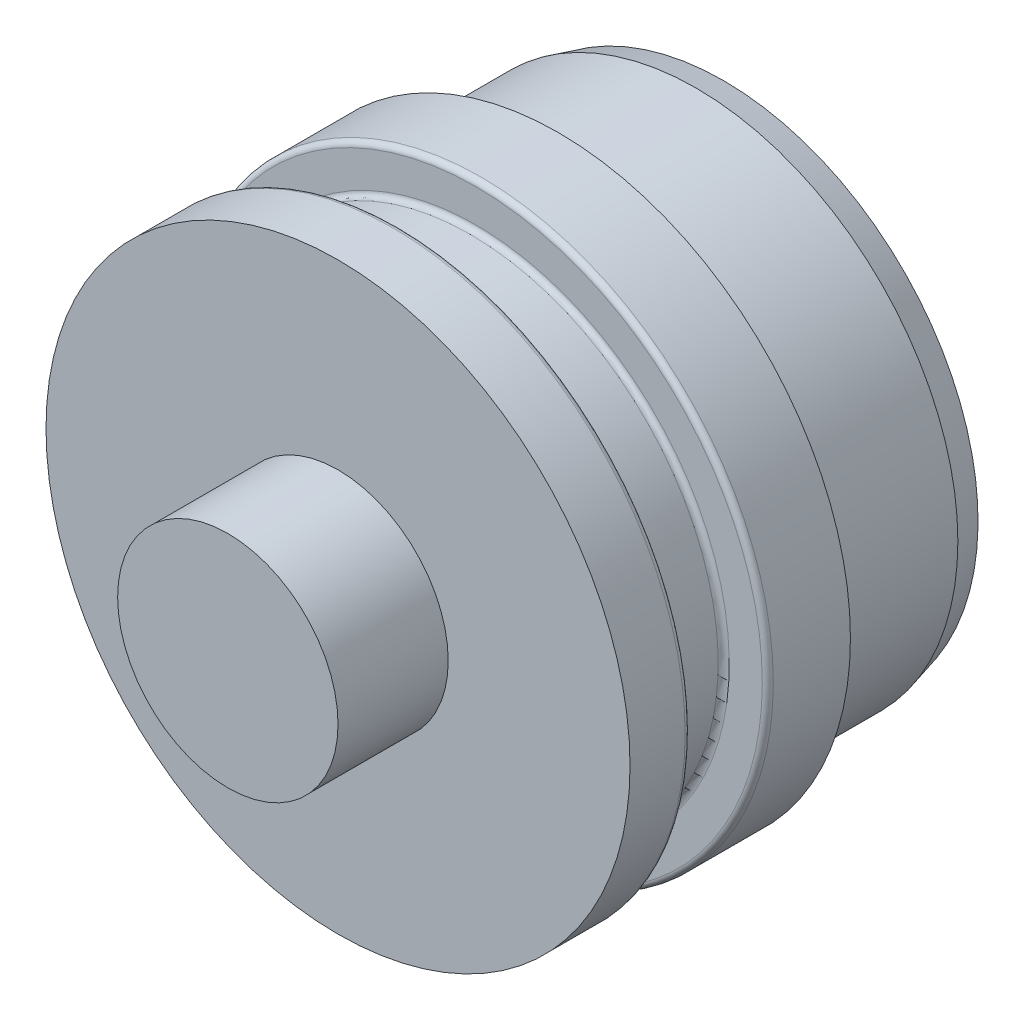
from build123d import *

# Parameters (mm, degrees)
CHAMFER1_SIZE  = 1.27
CHAMFER1_SIZE2 = 0.340295474
FILLET1_R      = 0.254


with BuildPart() as part:
    # Sketch1 → Revolve1 (revolve)
    with BuildSketch(Plane(origin=(0, 0, 0), x_dir=(0, 0, -1), z_dir=(1, 0, 0))):
        Polygon((0, 5.08), (0, 13.462), (2.794, 13.462), (2.794, 11.43), (6.35, 11.43), (6.35, 13.462), (10.16, 13.462), (10.16, 12.065), (17.78, 12.065), (17.78, 6.731), (5.08, 6.731), (5.08, 0), (0, 0), (-5.08, 0), (-5.08, 5.08), align=None)
    revolve(axis=Axis((0, 0, -5.08), (0, 0, 1)))

    # Chamfer1
    chamfer1_edges = [part.edges().sort_by_distance(p)[0] for p in [
        (0, -12.065, -17.78),
    ]]
    chamfer1_side = [part.faces().sort_by_distance(p)[0] for p in [
        (0, -12.065, -13.97),
    ]]
    chamfer(chamfer1_edges, length=CHAMFER1_SIZE, length2=CHAMFER1_SIZE2, reference=chamfer1_side[0])

    # Fillet1
    fillet1_edges = [part.edges().sort_by_distance(p)[0] for p in [
        (0, -13.462, -6.35),
        (0, -11.43, -6.35),
        (0, -11.43, -2.794),
        (0, -13.462, -2.794),
    ]]
    fillet(fillet1_edges, radius=FILLET1_R)


solid = part.part
